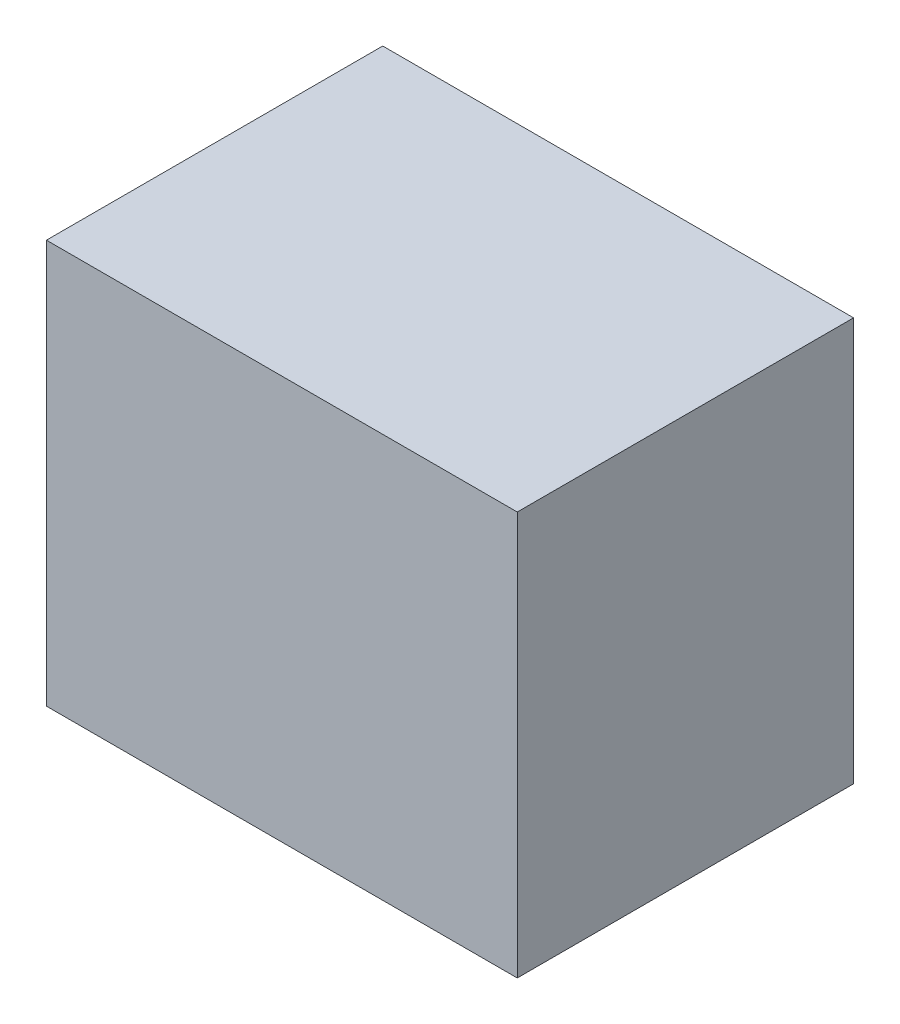
from build123d import *

# Parameters (mm, degrees)
SKETCH1_W           = 700
SKETCH1_H           = 600
BOSS_EXTRUDE1_DEPTH = 500
SHELL4_T            = 20


with BuildPart() as part:
    # Sketch1 → Boss-Extrude1 (new body)
    with BuildSketch(Plane.XY):
        with Locations((350, 300)):
            Rectangle(SKETCH1_W, SKETCH1_H)
    extrude(amount=BOSS_EXTRUDE1_DEPTH)

    # Shell4 (no face opened: a closed hollow body)
    add(offset(amount=-SHELL4_T, mode=Mode.PRIVATE), mode=Mode.SUBTRACT)


solid = part.part
